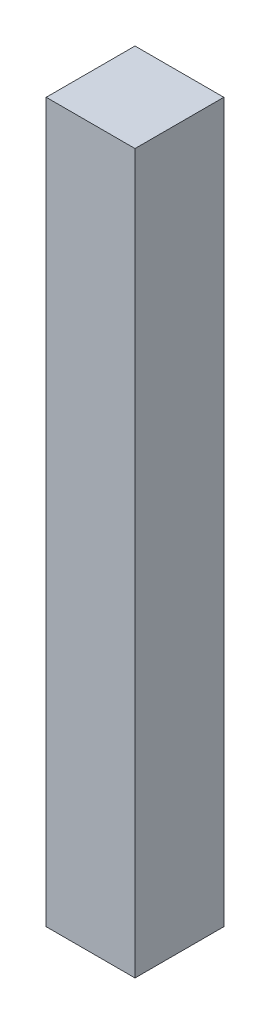
from build123d import *

# Parameters (mm, degrees)
SKETCH1_W           = 20
SKETCH1_H           = 20
BOSS_EXTRUDE1_DEPTH = 161.791264234


with BuildPart() as part:
    # Sketch1 → Boss-Extrude1 (new body)
    with BuildSketch(Plane(origin=(0, 0, 0), x_dir=(1, 0, 0), z_dir=(0, 1, 0))):
        with Locations((10, -10)):
            Rectangle(SKETCH1_W, SKETCH1_H)
    extrude(amount=BOSS_EXTRUDE1_DEPTH)


solid = part.part
